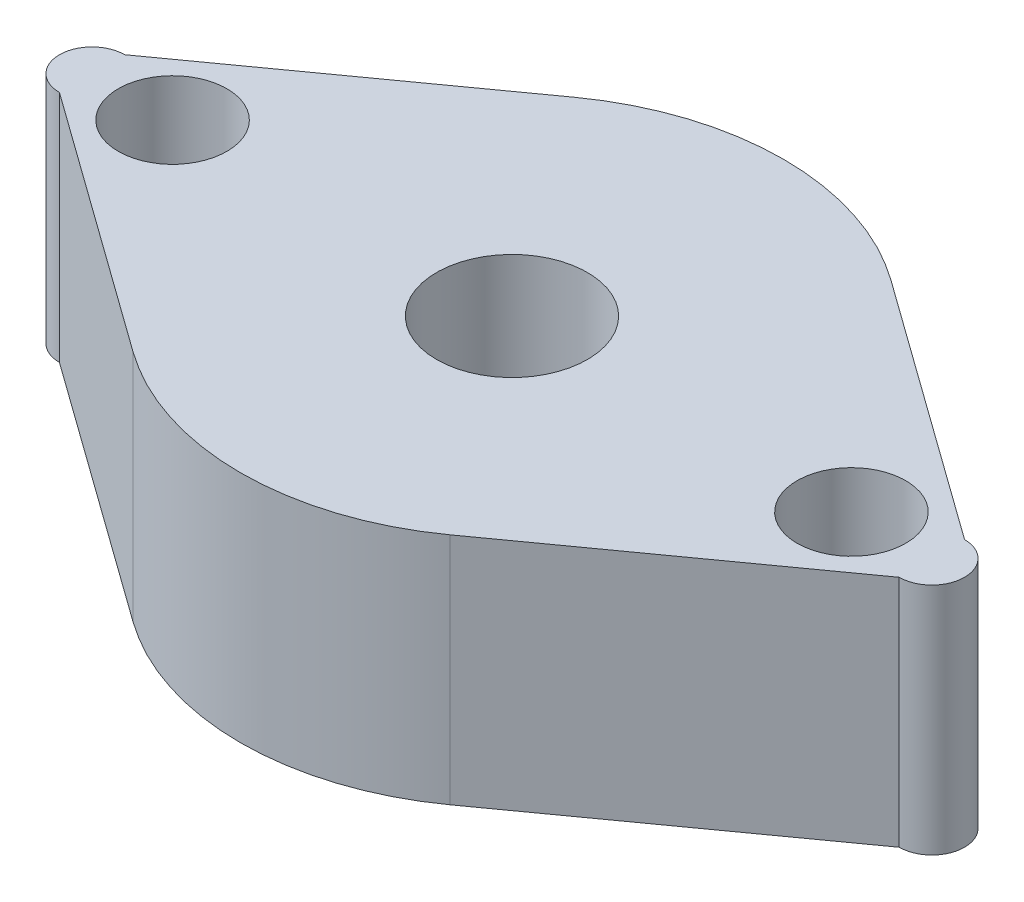
from build123d import *

# Parameters (mm, degrees)
SKETCH_1_R          = 3.6
EXTRUDE_1_DEPTH     = 15.5
SKETCH_2_R          = 5
CUT_EXTRUDE_1_DEPTH = 31.5


with BuildPart() as part:
    # 草图1 → 凸台-拉伸1 (new body)
    with BuildSketch(Plane(origin=(0, 0, 0), x_dir=(1, 0, 0), z_dir=(0, 1, 0))):
        with BuildLine():
            Line((27.835232693, 2.164767307), (10.503072433, 14.617984453))
            ThreePointArc((10.503072433, 14.617984453), (0, 18), (-10.503072433, 14.617984453))
            Line((-10.503072433, 14.617984453), (-27.835232693, 2.164767307))
            ThreePointArc((-27.835232693, 2.164767307), (-30, 0), (-27.835232693, -2.164767307))
            Line((-27.835232693, -2.164767307), (-10.503072433, -14.617984453))
            ThreePointArc((-10.503072433, -14.617984453), (0, -18), (10.503072433, -14.617984453))
            Line((10.503072433, -14.617984453), (27.835232693, -2.164767307))
            ThreePointArc((27.835232693, -2.164767307), (30, 0), (27.835232693, 2.164767307))
        make_face()
        with Locations(Location((-22.5, 0, 0), (0, 0, 270))):
            Circle(SKETCH_1_R, mode=Mode.SUBTRACT)
        with Locations(Location((22.5, 0, 0), (0, 0, 270))):
            Circle(SKETCH_1_R, mode=Mode.SUBTRACT)
    extrude(amount=EXTRUDE_1_DEPTH)

    # 草图2 → 切除-拉伸1 (cut)
    with BuildSketch(Plane(origin=(0, 15.5, 0), x_dir=(1, 0, 0), z_dir=(0, 1, 0))):
        with Locations(Location((0, 0, 0), (0, 0, 270))):
            Circle(SKETCH_2_R)
    extrude(amount=-CUT_EXTRUDE_1_DEPTH, mode=Mode.SUBTRACT)


solid = part.part
